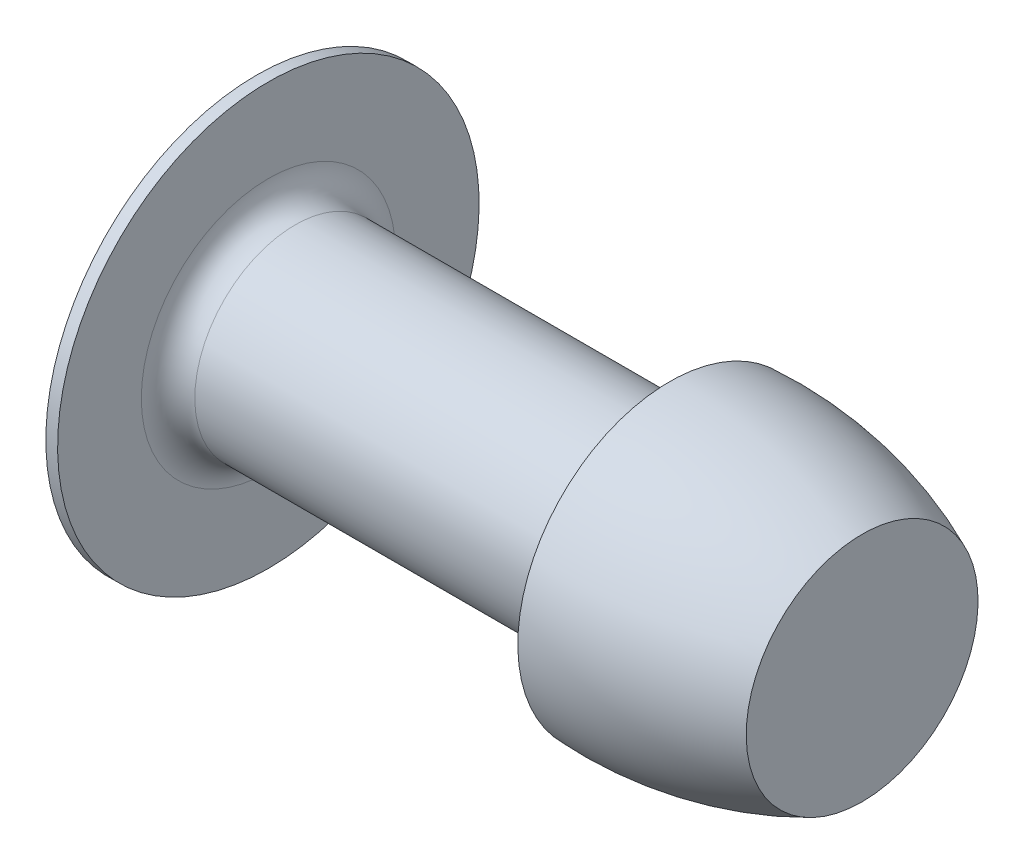
from build123d import *

# Parameters (mm, degrees)
FILLET1_R = 0.635


with BuildPart() as part:
    # Sketch1 → Body (revolve)
    with BuildSketch(Plane.XY, mode=Mode.PRIVATE) as body_sk:
        with BuildLine():
            Line((-0.2794, 5.0038), (0, 5.0038))
            Line((0, 5.0038), (0, 2.38125))
            Line((0, 2.38125), (9.526, 2.38125))
            Line((9.526, 2.38125), (9.526, 3.602736))
            ThreePointArc((9.526, 3.602736), (11.862096638, 3.446669338), (14.098, 2.75209))
            Line((14.098, 2.75209), (14.098, 0))
            Line((14.098, 0), (-1.524, 0))
            ThreePointArc((-1.524, 0), (-1.208180863, 2.578131281), (-0.2794, 5.0038))
        make_face()
    revolve(body_sk.sketch.rotate(Axis((-1.524, 0, 0), (1, 0, 0)), 180), axis=Axis((-1.524, 0, 0), (1, 0, 0)))

    # Fillet1
    fillet1_edges = [part.edges().sort_by_distance(p)[0] for p in [
        (0, 2.38125, 0),
    ]]
    fillet(fillet1_edges, radius=FILLET1_R)


solid = part.part
